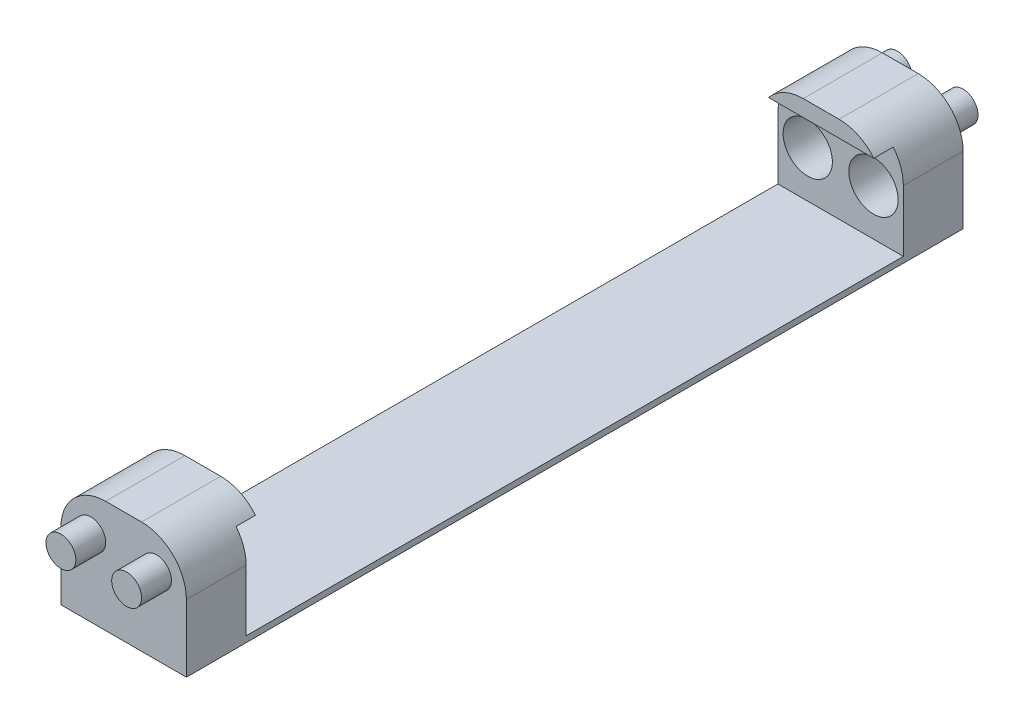
from build123d import *

# Parameters (mm, degrees)
BOSS_EXTRUDE1_DEPTH      = 42
BOSS_EXTRUDE1_DEPTH_BACK = 42
FILLET1_R                = 30
CUT_EXTRUDE1_DEPTH       = 250
CUT_EXTRUDE1_DEPTH_BACK  = 250
SKETCH2_R                = 16.5
SKETCH3_R                = 10
BOSS_EXTRUDE2_DEPTH      = 20
BOSS_EXTRUDE3_START      = 20
SKETCH4_R                = 10
BOSS_EXTRUDE3_DEPTH      = 20


with BuildPart() as part:
    # Sketch1 → Boss-Extrude1 (new, two sides: drawn at the far end of the back side and taken through both)
    with BuildSketch(Plane(origin=(0, 0, 0), x_dir=(0, 0, -1), z_dir=(1, 0, 0)).offset(-BOSS_EXTRUDE1_DEPTH_BACK)):
        Polygon((-260, 0), (260, 0), (260, 75), (207, 75), (207, 64), (220, 64), (220, 4), (-220, 4), (-220, 64), (-207, 64), (-207, 75), (-260, 75), align=None)
    extrude(amount=BOSS_EXTRUDE1_DEPTH + BOSS_EXTRUDE1_DEPTH_BACK)

    # Fillet1
    fillet1_edges = [part.edges().sort_by_distance(p)[0] for p in [
        (-42, 75, -233.5),
        (42, 75, -233.5),
        (-42, 75, 233.5),
        (42, 75, 233.5),
    ]]
    fillet(fillet1_edges, radius=FILLET1_R)

    # Sketch2 → Cut-Extrude1 (cut, two sides: drawn at the far end of the back side and taken through both)
    with BuildSketch(Plane.XY.offset(-CUT_EXTRUDE1_DEPTH_BACK)):
        with Locations((22, 35)):
            Circle(SKETCH2_R)
        with Locations((-22, 35)):
            Circle(SKETCH2_R)
    extrude(amount=CUT_EXTRUDE1_DEPTH + CUT_EXTRUDE1_DEPTH_BACK, mode=Mode.SUBTRACT)

    # Sketch3 → Boss-Extrude2 (add)
    with BuildSketch(Plane.XY.offset(260)):
        with Locations((22, 51)):
            Circle(SKETCH3_R)
        with Locations((-22, 51)):
            Circle(SKETCH3_R)
    extrude(amount=BOSS_EXTRUDE2_DEPTH)

    # Sketch4 → Boss-Extrude3 (add)
    with BuildSketch(Plane(origin=(0, 0, -260), x_dir=(-1, 0, 0), z_dir=(0, 0, -1)).offset(BOSS_EXTRUDE3_START)):
        with Locations((22, 51)):
            Circle(SKETCH4_R)
        with Locations((-22, 51)):
            Circle(SKETCH4_R)
    extrude(amount=-BOSS_EXTRUDE3_DEPTH)


solid = part.part
